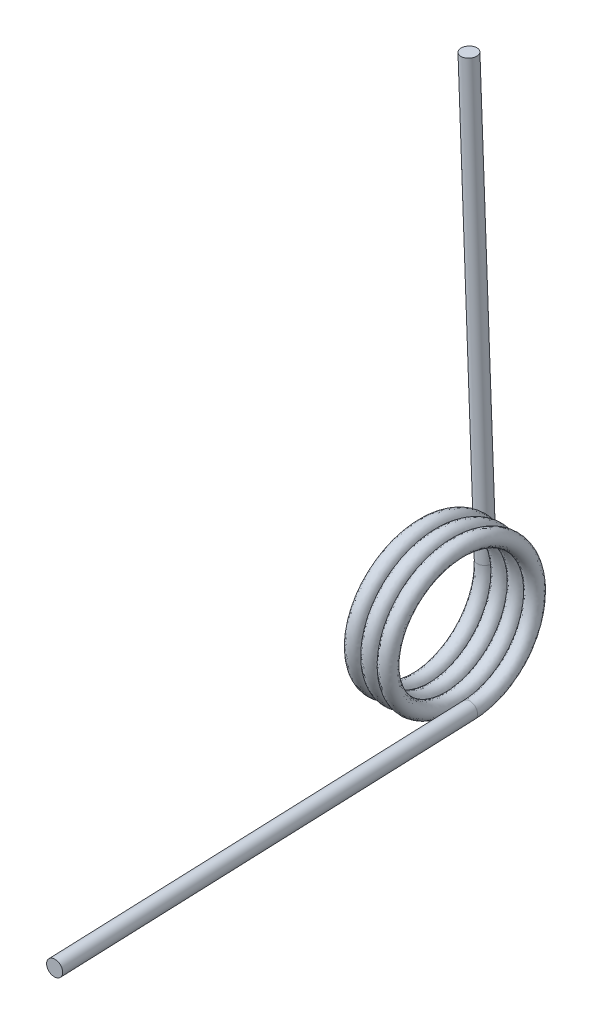
from build123d import *

# Parameters (mm, degrees)
SWEEP1_PITCH       = 0.4826
SWEEP1_HEIGHT      = 1.56845
SWEEP1_RADIUS      = 2.032
SWEEP1_START_ANGLE = -180
SKETCH2_R          = 0.2286
SKETCH3_R          = 0.2286
EXTRUDE1_DEPTH     = 12.7
SKETCH4_R          = 0.2286
EXTRUDE2_DEPTH     = 12.7


with BuildPart() as part:
    # Sweep1: sweep along a helix
    with BuildLine() as sweep1_path:
        add(Helix(SWEEP1_PITCH, SWEEP1_HEIGHT, SWEEP1_RADIUS, center=(0, 0, 0), direction=(1, 0, 0), lefthand=True, mode=Mode.PRIVATE).rotate(Axis((0, 0, 0), (1, 0, 0)), SWEEP1_START_ANGLE))
    # Sketch2 → Sweep1 (sweep)
    with BuildSketch(Plane(origin=(0, 0, -2.032), x_dir=(0.9992863711249069, 0.03777232431311157, 0), z_dir=(0.03777232431311157, -0.9992863711249069, 0))):
        Circle(SKETCH2_R)
    sweep(path=sweep1_path.line, is_frenet=True)

    # Sketch3 → Extrude1 (add)
    with BuildSketch(Plane(origin=(0, 0, 0), x_dir=(-0.9992863711249069, -0.03777232431311157, 0), z_dir=(-0.03777232431311157, 0.9992863711249069, 0))):
        with Locations(Location((0, -2.032, 0), (0, 0, 180))):
            Circle(SKETCH3_R)
    extrude(amount=EXTRUDE1_DEPTH)

    # Sketch4 → Extrude2 (add)
    with BuildSketch(Plane(origin=(0.002237784, 0, 0.059201724), x_dir=(0.999286371124907, -2.5931357631694875e-15, -0.03777232431311157), z_dir=(0.03777232431311157, 4.358177714039034e-14, 0.999286371124907))):
        with Locations((1.567330709, -2.032)):
            Circle(SKETCH4_R)
    extrude(amount=EXTRUDE2_DEPTH)


solid = part.part
